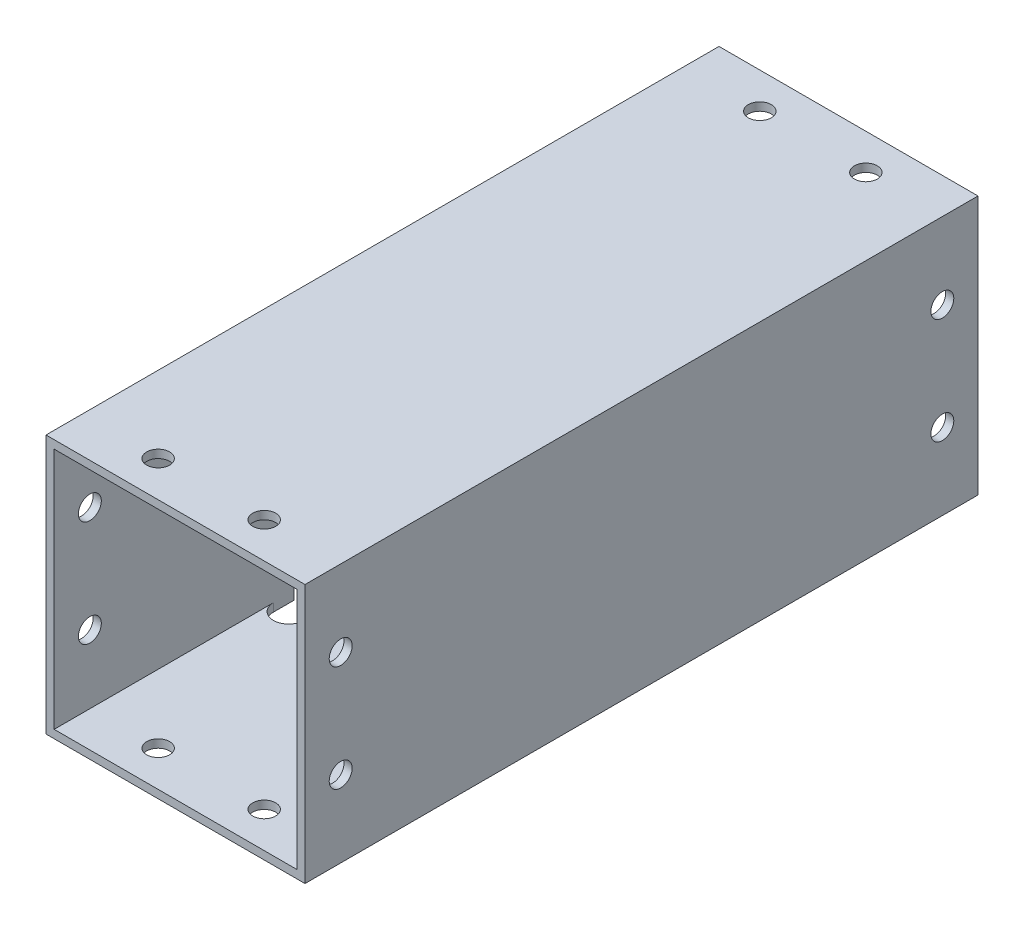
from build123d import *

# Parameters (mm, degrees)
SKETCH1_W                     = 50.8
SKETCH1_H                     = 50.8
SKETCH1_W_2                   = 47.6
SKETCH1_H_2                   = 47.6
BOSS_EXTRUDE1_DEPTH           = 132
M4_CLEARANCE_HOLE1_AT_2_COUNT = 2
M4_CLEARANCE_HOLE1_AT_2_PITCH = 20.8
CIRPATTERN1_COUNT             = 4
CUT_EXTRUDE1_DEPTH            = 5
CUT_EXTRUDE2_DEPTH            = 10


with BuildPart() as part:
    # Sketch1 → Boss-Extrude1 (new body)
    with BuildSketch(Plane.XY):
        Rectangle(SKETCH1_W, SKETCH1_H)
        Rectangle(SKETCH1_W_2, SKETCH1_H_2, mode=Mode.SUBTRACT)
    extrude(amount=BOSS_EXTRUDE1_DEPTH)

    # Sketch5 → M4 Clearance Hole1 (revolve, cut)
    with BuildSketch(Plane(origin=(-25.4, 10.4, 7), x_dir=(0, 0, 1), z_dir=(0, 1, 0))):
        Polygon((0, 0), (0, 12.851936393), (2.25, 11.5), (2.25, 0), align=None)
    m4_clearance_hole1 = revolve(axis=Axis((-31.75, 10.4, 7), (1, 0, 0)), mode=Mode.SUBTRACT)

    # M4 Clearance Hole1 at 2: M4 Clearance Hole1 ×2
    with Locations(*[(0, -i * M4_CLEARANCE_HOLE1_AT_2_PITCH, 0) for i in range(1, M4_CLEARANCE_HOLE1_AT_2_COUNT)]):
        add(m4_clearance_hole1, mode=Mode.SUBTRACT)

    # CirPattern1: M4 Clearance Hole1 ×4 about axis
    cirpattern1_axis = Axis((0, 0, 0), (0, 0, 1))
    for i in range(1, CIRPATTERN1_COUNT):
        add(m4_clearance_hole1.rotate(cirpattern1_axis, i * 360 / CIRPATTERN1_COUNT), mode=Mode.SUBTRACT)

    # CirPattern1 copy 1 sketch → CirPattern1 copy 1 (revolve, cut)
    with BuildSketch(Plane(origin=(10.4, -25.4, 7), x_dir=(0, 0, 1), z_dir=(-1, 0, 0))):
        Polygon((0, 0), (0, 12.851936393), (2.25, 11.5), (2.25, 0), align=None)
    revolve(axis=Axis((10.4, -31.75, 7), (0, 1, 0)), mode=Mode.SUBTRACT)

    # CirPattern1 copy 2 sketch → CirPattern1 copy 2 (revolve, cut)
    with BuildSketch(Plane(origin=(25.4, 10.4, 7), x_dir=(0, 0, 1), z_dir=(0, -1, 0))):
        Polygon((0, 0), (0, 12.851936393), (2.25, 11.5), (2.25, 0), align=None)
    revolve(axis=Axis((31.75, 10.4, 7), (-1, 0, 0)), mode=Mode.SUBTRACT)

    # CirPattern1 copy 3 sketch → CirPattern1 copy 3 (revolve, cut)
    with BuildSketch(Plane(origin=(-10.4, 25.4, 7), x_dir=(0, 0, 1), z_dir=(1, 0, 0))):
        Polygon((0, 0), (0, 12.851936393), (2.25, 11.5), (2.25, 0), align=None)
    revolve(axis=Axis((-10.4, 31.75, 7), (0, -1, 0)), mode=Mode.SUBTRACT)

    # Mirror3: M4 Clearance Hole1 across plane
    add(m4_clearance_hole1.mirror(Plane.XY.offset(66)), mode=Mode.SUBTRACT)

    # Mirror3 copy 1 sketch → Mirror3 copy 1 (revolve, cut)
    with BuildSketch(Plane(origin=(-25.4, -10.4, 125), x_dir=(0, 0, -1), z_dir=(0, 1, 0))):
        Polygon((0, 0), (0, -12.851936393), (2.25, -11.5), (2.25, 0), align=None)
    revolve(axis=Axis((-31.75, -10.4, 125), (-1, 0, 0)), mode=Mode.SUBTRACT)

    # Mirror3 copy 2 sketch → Mirror3 copy 2 (revolve, cut)
    with BuildSketch(Plane(origin=(-10.4, -25.4, 125), x_dir=(0, 0, -1), z_dir=(-1, 0, 0))):
        Polygon((0, 0), (0, -12.851936393), (2.25, -11.5), (2.25, 0), align=None)
    revolve(axis=Axis((-10.4, -31.75, 125), (0, -1, 0)), mode=Mode.SUBTRACT)

    # Mirror3 copy 3 sketch → Mirror3 copy 3 (revolve, cut)
    with BuildSketch(Plane(origin=(25.4, -10.4, 125), x_dir=(0, 0, -1), z_dir=(0, -1, 0))):
        Polygon((0, 0), (0, -12.851936393), (2.25, -11.5), (2.25, 0), align=None)
    revolve(axis=Axis((31.75, -10.4, 125), (1, 0, 0)), mode=Mode.SUBTRACT)

    # Mirror3 copy 4 sketch → Mirror3 copy 4 (revolve, cut)
    with BuildSketch(Plane(origin=(10.4, 25.4, 125), x_dir=(0, 0, -1), z_dir=(1, 0, 0))):
        Polygon((0, 0), (0, -12.851936393), (2.25, -11.5), (2.25, 0), align=None)
    revolve(axis=Axis((10.4, 31.75, 125), (0, 1, 0)), mode=Mode.SUBTRACT)

    # Mirror3 copy 5 sketch → Mirror3 copy 5 (revolve, cut)
    with BuildSketch(Plane(origin=(10.4, -25.4, 125), x_dir=(0, 0, -1), z_dir=(-1, 0, 0))):
        Polygon((0, 0), (0, -12.851936393), (2.25, -11.5), (2.25, 0), align=None)
    revolve(axis=Axis((10.4, -31.75, 125), (0, -1, 0)), mode=Mode.SUBTRACT)

    # Mirror3 copy 6 sketch → Mirror3 copy 6 (revolve, cut)
    with BuildSketch(Plane(origin=(25.4, 10.4, 125), x_dir=(0, 0, -1), z_dir=(0, -1, 0))):
        Polygon((0, 0), (0, -12.851936393), (2.25, -11.5), (2.25, 0), align=None)
    revolve(axis=Axis((31.75, 10.4, 125), (1, 0, 0)), mode=Mode.SUBTRACT)

    # Mirror3 copy 7 sketch → Mirror3 copy 7 (revolve, cut)
    with BuildSketch(Plane(origin=(-10.4, 25.4, 125), x_dir=(0, 0, -1), z_dir=(1, 0, 0))):
        Polygon((0, 0), (0, -12.851936393), (2.25, -11.5), (2.25, 0), align=None)
    revolve(axis=Axis((-10.4, 31.75, 125), (0, 1, 0)), mode=Mode.SUBTRACT)

    # Sketch7 → Cut-Extrude1 (cut)
    with BuildSketch(Plane.ZY.offset(25.4)):
        with BuildLine():
            Line((85, -15.1), (85, -30.1))
            ThreePointArc((85, -30.1), (82, -33.1), (79, -30.1))
            Line((79, -30.1), (79, -15.1))
            ThreePointArc((79, -15.1), (82, -12.1), (85, -15.1))
        make_face()
    extrude(amount=-CUT_EXTRUDE1_DEPTH, mode=Mode.SUBTRACT)

    # Sketch8 → Cut-Extrude2 (cut)
    with BuildSketch(Plane.XZ.offset(25.4)):
        with BuildLine():
            Line((-23.8, 75), (-23.8, 89))
            ThreePointArc((-23.8, 89), (-20.8, 92), (-17.8, 89))
            Line((-17.8, 89), (-17.8, 75))
            ThreePointArc((-17.8, 75), (-20.8, 72), (-23.8, 75))
        make_face()
    extrude(amount=-CUT_EXTRUDE2_DEPTH, mode=Mode.SUBTRACT)


solid = part.part
